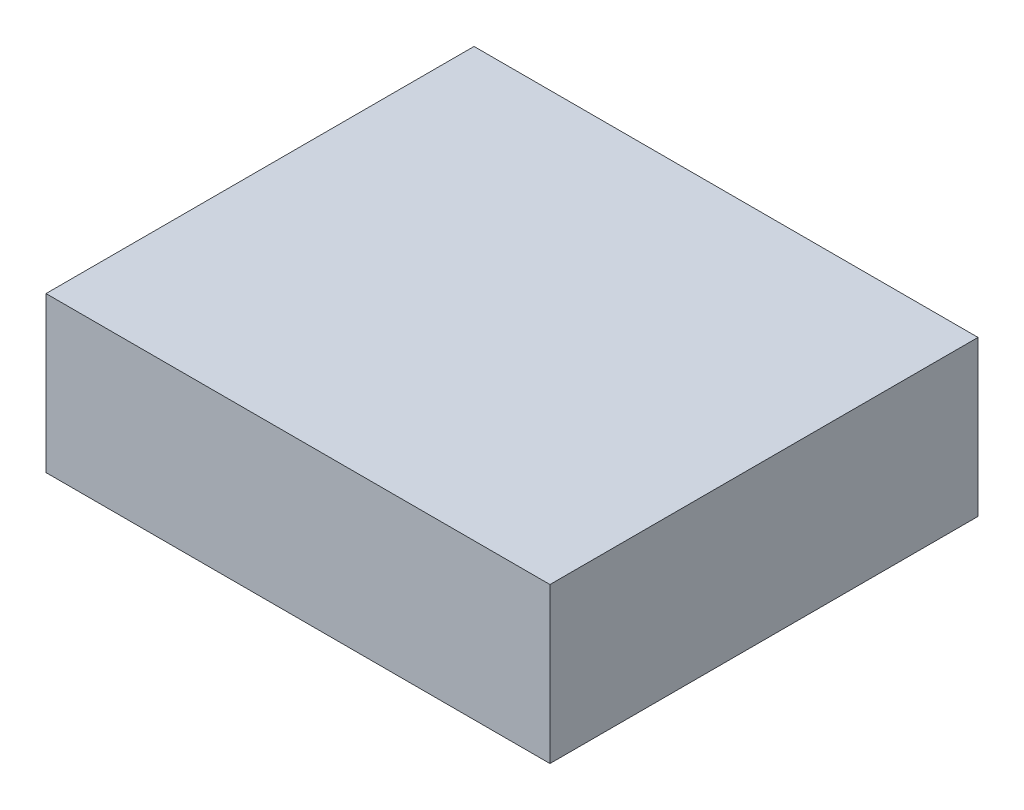
from build123d import *

# Parameters (mm, degrees)
SKETCH1_W           = 312
SKETCH1_H           = 265
BOSS_EXTRUDE1_DEPTH = 96


with BuildPart() as part:
    # Sketch1 → Boss-Extrude1 (new body)
    with BuildSketch(Plane(origin=(0, 0, 0), x_dir=(1, 0, 0), z_dir=(0, 1, 0))):
        Rectangle(SKETCH1_W, SKETCH1_H)
    extrude(amount=BOSS_EXTRUDE1_DEPTH)


solid = part.part
